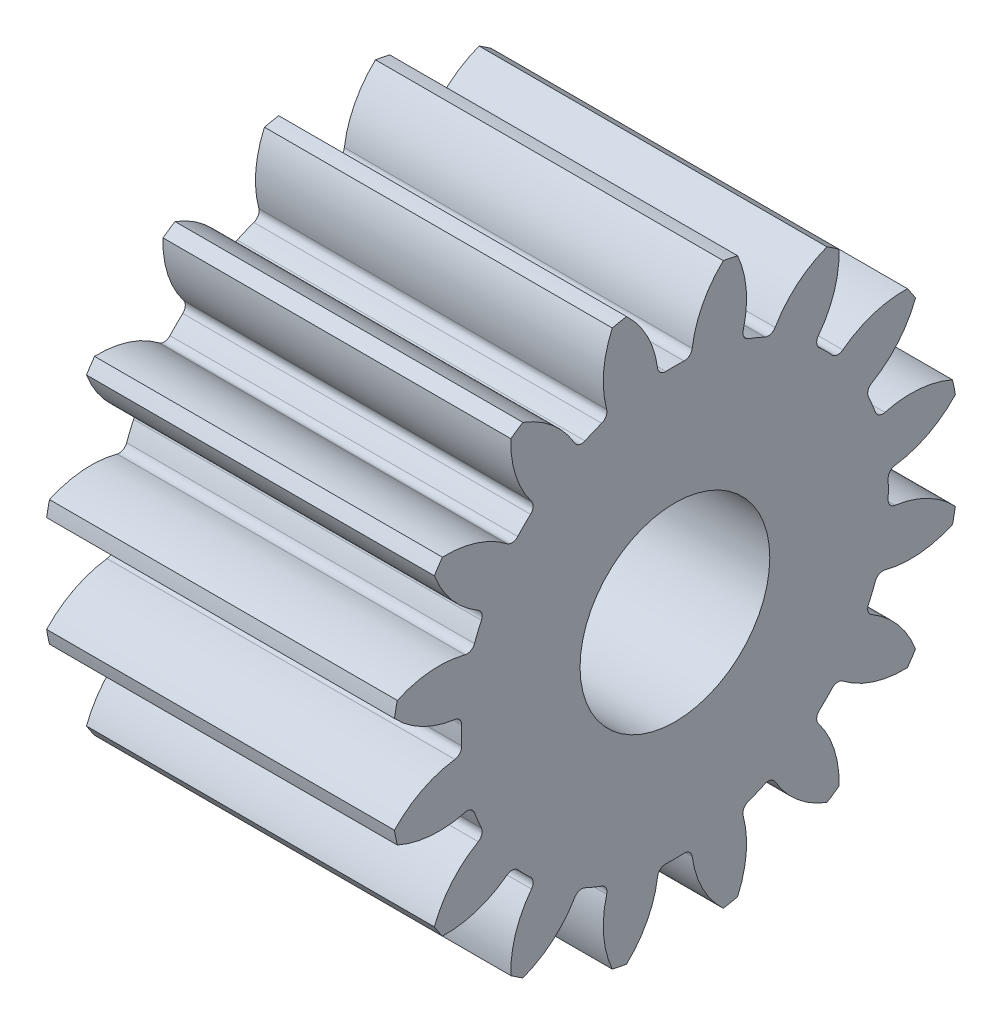
from build123d import *

# Parameters (mm, degrees)
BASPROSKE_W                = 5.5
BASPROSKE_H                = 4.5
TOOTHCUT_DEPTH             = 9.411301921
ROOTFILLETS_R              = 0.126
TEETHCUTS_COUNT            = 16
ROOTFILLETS_OF_TEETHCUTS_R = 0.126
HOLESKE_R                  = 1.5
HOLE_DEPTH                 = 9.341440945


with BuildPart() as part:
    # BasProSke → Base-Revolve (revolve)
    with BuildSketch(Plane(origin=(0, 0, 0), x_dir=(1, 0, 0), z_dir=(0, 1, 0)), mode=Mode.PRIVATE) as base_revolve_sk:
        with Locations((2.75, 2.25)):
            Rectangle(BASPROSKE_W, BASPROSKE_H)
    revolve(base_revolve_sk.sketch.rotate(Axis((-10, 0, 0), (1, 0, 0)), 180), axis=Axis((-10, 0, 0), (1, 0, 0)))

    # TooCutSke → ToothCut (cut, through all)
    with BuildSketch(Plane(origin=(0, 0, 0), x_dir=(0, 0, -1), z_dir=(1, 0, 0))):
        with BuildLine():
            ThreePointArc((0.261866103, 3.363822549), (0, 3.374), (-0.261866103, 3.363822549))
            ThreePointArc((-0.261866103, 3.363822549), (-0.417714668, 3.961827375), (-0.788562282, 4.456165918))
            ThreePointArc((-0.788562282, 4.456165918), (0, 4.5254), (0.788562282, 4.456165918))
            ThreePointArc((0.788562282, 4.456165918), (0.417714668, 3.961827375), (0.261866103, 3.363822549))
        make_face()
    toothcut = extrude(amount=TOOTHCUT_DEPTH, mode=Mode.SUBTRACT)

    # RootFillets
    rootfillets_edges = [part.edges().sort_by_distance(p)[0] for p in [
        (2.75, 3.363822549, -0.261866103),
        (2.75, 3.363822549, 0.261866103),
    ]]
    fillet(rootfillets_edges, radius=ROOTFILLETS_R)

    # TeethCuts: ToothCut ×16 about axis
    teethcuts_axis = Axis((0, 0, 0), (1, 0, 0))
    for i in range(1, TEETHCUTS_COUNT):
        add(toothcut.rotate(teethcuts_axis, i * 360 / TEETHCUTS_COUNT), mode=Mode.SUBTRACT)

    # RootFillets of TeethCuts
    rootfillets_of_teethcuts_edges = [part.edges().sort_by_distance(p)[0] for p in [
        (2.75, 3.207978624, 1.045346426),
        (2.75, 3.007554985, 1.529211892),
        (2.75, 2.563749033, 2.193414438),
        (2.75, 2.193414438, 2.563749033),
        (2.75, 1.529211892, 3.007554985),
        (2.75, 1.045346426, 3.207978624),
        (2.75, 0.261866103, 3.363822549),
        (2.75, -0.261866103, 3.363822549),
        (2.75, -1.045346426, 3.207978624),
        (2.75, -1.529211892, 3.007554985),
        (2.75, -2.193414438, 2.563749033),
        (2.75, -2.563749033, 2.193414438),
        (2.75, -3.007554985, 1.529211892),
        (2.75, -3.207978624, 1.045346426),
        (2.75, -3.363822549, 0.261866103),
        (2.75, -3.363822549, -0.261866103),
        (2.75, -3.207978624, -1.045346426),
        (2.75, -3.007554985, -1.529211892),
        (2.75, -2.563749033, -2.193414438),
        (2.75, -2.193414438, -2.563749033),
        (2.75, -1.529211892, -3.007554985),
        (2.75, -1.045346426, -3.207978624),
        (2.75, -0.261866103, -3.363822549),
        (2.75, 0.261866103, -3.363822549),
        (2.75, 1.045346426, -3.207978624),
        (2.75, 1.529211892, -3.007554985),
        (2.75, 2.193414438, -2.563749033),
        (2.75, 2.563749033, -2.193414438),
        (2.75, 3.007554985, -1.529211892),
        (2.75, 3.207978624, -1.045346426),
    ]]
    fillet(rootfillets_of_teethcuts_edges, radius=ROOTFILLETS_OF_TEETHCUTS_R)

    # HoleSke → Hole (cut, through all)
    with BuildSketch(Plane(origin=(5.5, 0, 0), x_dir=(0, 0, -1), z_dir=(1, 0, 0))):
        Circle(HOLESKE_R)
    extrude(amount=-HOLE_DEPTH, mode=Mode.SUBTRACT)


solid = part.part
